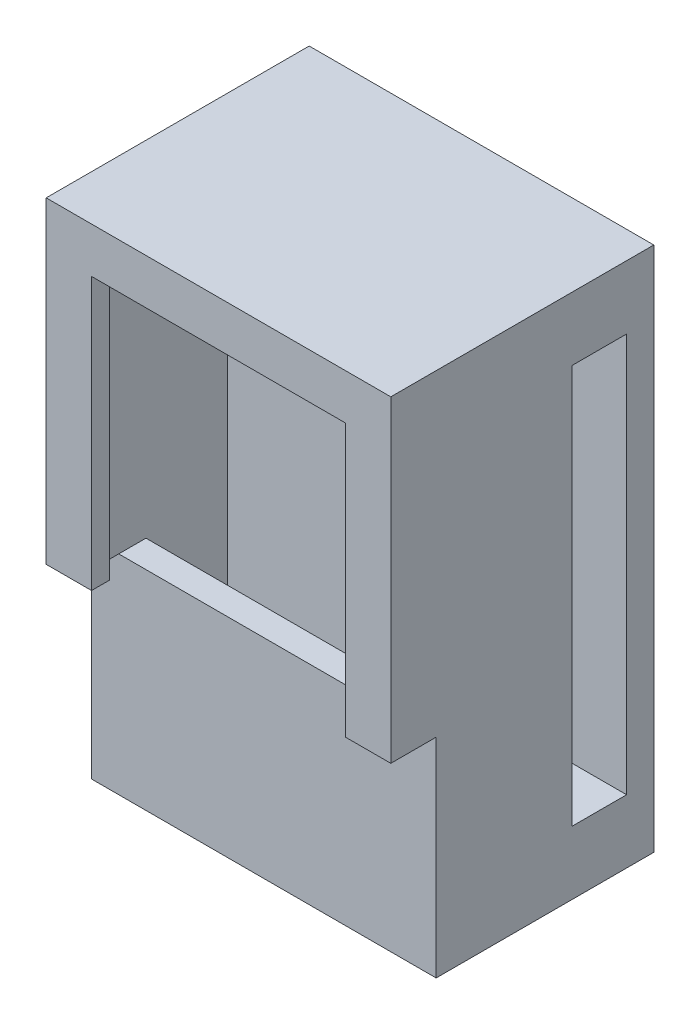
from build123d import *

# Parameters (mm, degrees)
CROQUIS1_W              = 19
CROQUIS1_H              = 29
SALIENTE_EXTRUIR1_DEPTH = 6
SALIENTE_EXTRUIR2_DEPTH = 4.5
CROQUIS3_W              = 19
CROQUIS3_H              = 11.5
SALIENTE_EXTRUIR3_DEPTH = 1.5
CROQUIS4_W              = 12
CROQUIS4_H              = 4
CORTAR_EXTRUIR1_DEPTH   = 5
SALIENTE_EXTRUIR4_DEPTH = 7.5
SALIENTE_EXTRUIR5_DEPTH = 1
CORTAR_EXTRUIR2_START   = -19
CROQUIS7_W              = 3
CROQUIS7_H              = 22
CORTAR_EXTRUIR2_DEPTH   = 19


with BuildPart() as part:
    # Croquis1 → Saliente-Extruir1 (new body)
    with BuildSketch(Plane.XY):
        with Locations((-22.223018523, 5.939759036)):
            Rectangle(CROQUIS1_W, CROQUIS1_H)
    extrude(amount=SALIENTE_EXTRUIR1_DEPTH)

    # Croquis2 → Saliente-Extruir2 (add)
    with BuildSketch(Plane.XY.offset(6)):
        Polygon((-31.723018523, -8.560240964), (-31.723018523, 2.939759036), (-30.223018523, 2.939759036), (-30.223018523, -7.060240964), (-14.223018523, -7.060240964), (-14.223018523, 2.939759036), (-12.723018523, 2.939759036), (-12.723018523, -8.560240964), align=None)
    extrude(amount=SALIENTE_EXTRUIR2_DEPTH)

    # Croquis3 → Saliente-Extruir3 (add)
    with BuildSketch(Plane.XY.offset(10.5)):
        with Locations((-22.223018523, -2.810240964)):
            Rectangle(CROQUIS3_W, CROQUIS3_H)
    extrude(amount=SALIENTE_EXTRUIR3_DEPTH)

    # Croquis4 → Cortar-Extruir1 (cut)
    with BuildSketch(Plane.XZ.offset(8.560240964)):
        with Locations((-21.223018523, 7.3)):
            Rectangle(CROQUIS4_W, CROQUIS4_H)
    extrude(amount=-CORTAR_EXTRUIR1_DEPTH, mode=Mode.SUBTRACT)

    # Croquis5 → Saliente-Extruir4 (add)
    with BuildSketch(Plane.XY.offset(6)):
        Polygon((-30.223018523, 2.939759036), (-31.723018523, 2.939759036), (-31.723018523, 20.439759036), (-12.723018523, 20.439759036), (-12.723018523, 2.939759036), (-14.223018523, 2.939759036), (-14.223018523, 18.939759036), (-30.223018523, 18.939759036), align=None)
    extrude(amount=SALIENTE_EXTRUIR4_DEPTH)

    # Croquis6 → Saliente-Extruir5 (add)
    with BuildSketch(Plane.XY.offset(13.5)):
        Polygon((-29.223018523, 2.939759036), (-31.723018523, 2.939759036), (-31.723018523, 20.439759036), (-12.723018523, 20.439759036), (-12.723018523, 2.939759036), (-15.223018523, 2.939759036), (-15.223018523, 17.939759036), (-29.223018523, 17.939759036), align=None)
    extrude(amount=SALIENTE_EXTRUIR5_DEPTH)

    # Croquis7 → Cortar-Extruir2 (cut)
    with BuildSketch(Plane(origin=(-12.723018523, 0, 0), x_dir=(0, 0, -1), z_dir=(1, 0, 0)).offset(CORTAR_EXTRUIR2_START)):
        with Locations((-3, 5.939759036)):
            Rectangle(CROQUIS7_W, CROQUIS7_H)
    extrude(amount=CORTAR_EXTRUIR2_DEPTH, mode=Mode.SUBTRACT)


solid = part.part
